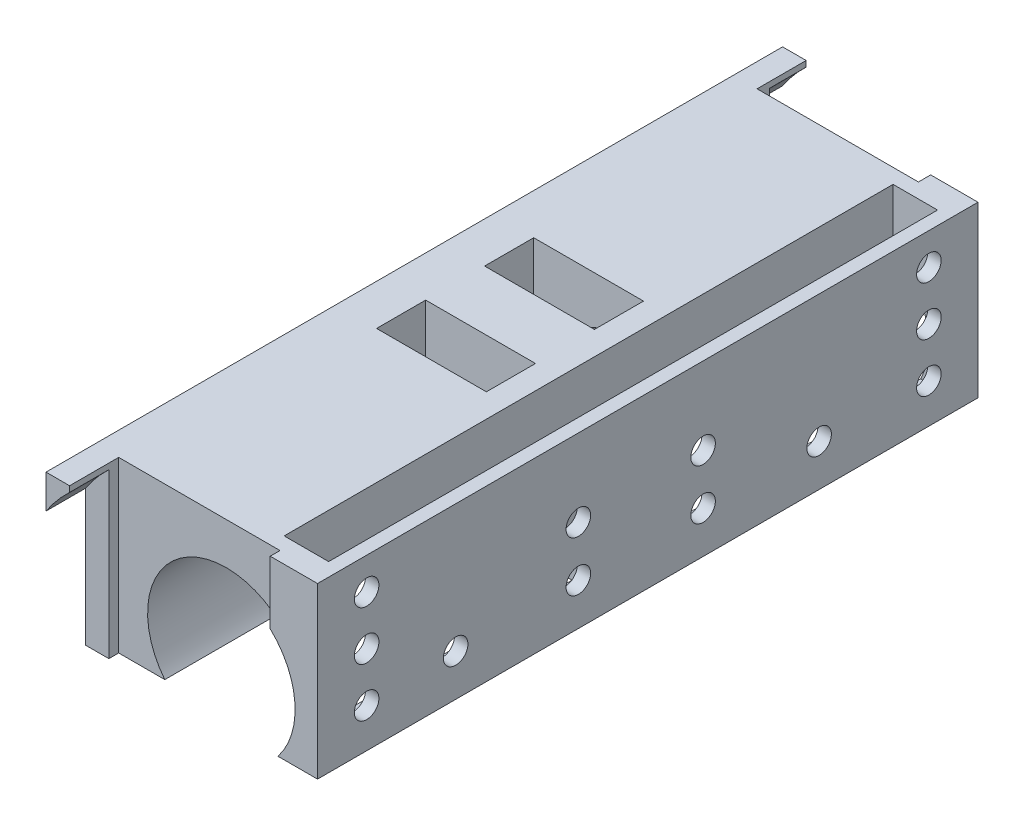
from build123d import *

# Parameters (mm, degrees)
CUBE_W                    = 150
CUBE_H                    = 150
BOSS_EXTRU_1_DEPTH        = 34.5
PAVE_W                    = 96
PAVE_H                    = 144
ENL_V_MAT_EXTRU_1_DEPTH   = 31.5
VIS1_R                    = 2.5
ENL_V_MAT_EXTRU_2_DEPTH   = 5
ENL_V_START               = -5
VIS2_R                    = 2.5
ENL_V_MAT_EXTRU_3_DEPTH   = 5
PAVE_PROCHE_MOTEUR_W      = 12.5
PAVE_PROCHE_MOTEUR_H      = 124
ENL_V_MAT_EXTRU_4_DEPTH   = 31.5
PAVE_ROUE_LIBRE_W         = 32.86
PAVE_ROUE_LIBRE_H         = 15.696676457
PAVE_ROUE_LIBRE_H_2       = 18.419496328
ENL_V_MAT_EXTRU_5_DEPTH   = 36
CABLES_W                  = 22.36
CABLES_H                  = 10
ENL_V_MAT_EXTRU_6_DEPTH   = 36
ROUE_EXT_R                = 32
ENL_V_MAT_EXTRU_7_DEPTH   = 8
ROUE_INTER_R              = 16.02
ENL_V_MAT_EXTRU_8_DEPTH   = 69
ENL_V_START_2             = -7.5
ROUE_EXT2_R               = 32
ENL_V_MAT_EXTRU_9_DEPTH   = 7.5
ENL_V_START_3             = -69
ROUE_INTER2_R             = 16.02
ENL_V_MAT_EXTRU_10_DEPTH  = 69
VIS_MOTEUR_POUR_SUPPORT_R = 2.5
ENL_V_MAT_EXTRU_11_DEPTH  = 10
BOSS_EXTRU_2_DEPTH        = 10
ESQUISSE2_R               = 2.5
ENL_V_MAT_EXTRU_12_DEPTH  = 10
ESQUISSE3_W               = 3.439870431
ESQUISSE3_H               = 124
BOSS_EXTRU_3_DEPTH        = 31
ESQUISSE5_W               = 3.439870431
ESQUISSE5_H               = 124
BOSS_EXTRU_4_DEPTH        = 0.5
ESQUISSE6_R               = 2.5
ENL_V_MAT_EXTRU_13_DEPTH  = 10
ESQUISSE7_R               = 2.5
ENL_V_MAT_EXTRU_14_DEPTH  = 10
ESQUISSE8_R               = 2.5
ENL_V_MAT_EXTRU_15_DEPTH  = 10
ESQUISSE10_W              = 102.704284834
ESQUISSE10_H              = 150
ENL_V_MAT_EXTRU_16_DEPTH  = 40


with BuildPart() as part:
    # Cube → Boss.-Extru.1 (new body)
    with BuildSketch(Plane(origin=(0, 0, 0), x_dir=(1, 0, 0), z_dir=(0, 1, 0))):
        with Locations((-34.210526316, -11.513157895)):
            Rectangle(CUBE_W, CUBE_H)
    extrude(amount=BOSS_EXTRU_1_DEPTH)

    # Pave → Enlèv. mat.-Extru.1 (cut)
    with BuildSketch(Plane(origin=(0, 34.5, 0), x_dir=(1, 0, 0), z_dir=(0, 1, 0))):
        with Locations((-10.210526316, -11.513157895)):
            Rectangle(PAVE_W, PAVE_H)
    extrude(amount=-ENL_V_MAT_EXTRU_1_DEPTH, mode=Mode.SUBTRACT)

    # Vis1 → Enlèv. mat.-Extru.2 (cut)
    with BuildSketch(Plane.XY.offset(86.513157895)):
        with Locations((33.789473684, 10)):
            Circle(VIS1_R)
        with Locations((33.789473684, 20)):
            Circle(VIS1_R)
        with Locations((33.789473684, 30)):
            Circle(VIS1_R)
    extrude(amount=-ENL_V_MAT_EXTRU_2_DEPTH, mode=Mode.SUBTRACT)

    # Vis2 → Enlèv. mat.-Extru.3 (cut)
    with BuildSketch(Plane(origin=(0, 0, -63.486842105), x_dir=(-1, 0, 0), z_dir=(0, 0, -1)).offset(ENL_V_START)):
        with Locations(Location((-33.789473684, 10, 0), (0, 0, 180))):
            Circle(VIS2_R)
        with Locations(Location((-33.789473684, 20, 0), (0, 0, 180))):
            Circle(VIS2_R)
        with Locations(Location((-33.789473684, 30, 0), (0, 0, 180))):
            Circle(VIS2_R)
    extrude(amount=ENL_V_MAT_EXTRU_3_DEPTH, mode=Mode.SUBTRACT)

    # Pave proche moteur → Enlèv. mat.-Extru.4 (cut)
    with BuildSketch(Plane(origin=(0, 34.5, 0), x_dir=(1, 0, 0), z_dir=(0, 1, 0))):
        with Locations((-67.460526316, -11.513157895)):
            Rectangle(PAVE_PROCHE_MOTEUR_W, PAVE_PROCHE_MOTEUR_H)
    extrude(amount=-ENL_V_MAT_EXTRU_4_DEPTH, mode=Mode.SUBTRACT)

    # Pave Roue libre → Enlèv. mat.-Extru.5 (cut)
    with BuildSketch(Plane(origin=(0, 34.5, 0), x_dir=(1, 0, 0), z_dir=(0, 1, 0))):
        with Locations((-87.980526316, 61.335180334)):
            Rectangle(PAVE_ROUE_LIBRE_W, PAVE_ROUE_LIBRE_H)
        with Locations((-87.980526316, -85.722906059)):
            Rectangle(PAVE_ROUE_LIBRE_W, PAVE_ROUE_LIBRE_H_2)
    extrude(amount=-ENL_V_MAT_EXTRU_5_DEPTH, mode=Mode.SUBTRACT)

    # Cables → Enlèv. mat.-Extru.6 (cut)
    with BuildSketch(Plane(origin=(0, 34.5, 0), x_dir=(1, 0, 0), z_dir=(0, 1, 0))):
        with Locations((-89.710526316, -0.513157895)):
            Rectangle(CABLES_W, CABLES_H)
        with Locations((-89.710526316, -22.513157895)):
            Rectangle(CABLES_W, CABLES_H)
    extrude(amount=-ENL_V_MAT_EXTRU_6_DEPTH, mode=Mode.SUBTRACT)

    # Roue ext → Enlèv. mat.-Extru.7 (cut)
    with BuildSketch(Plane.XY.offset(86.513157895)):
        with Locations((-82.5, 10)):
            Circle(ROUE_EXT_R)
    extrude(amount=-ENL_V_MAT_EXTRU_7_DEPTH, mode=Mode.SUBTRACT)

    # Roue inter → Enlèv. mat.-Extru.8 (cut)
    with BuildSketch(Plane.XY.offset(86.513157895)):
        with Locations((-82.5, 10)):
            Circle(ROUE_INTER_R)
    extrude(amount=-ENL_V_MAT_EXTRU_8_DEPTH, mode=Mode.SUBTRACT)

    # Roue ext2 → Enlèv. mat.-Extru.9 (cut)
    with BuildSketch(Plane(origin=(0, 0, -63.486842105), x_dir=(-1, 0, 0), z_dir=(0, 0, -1)).offset(ENL_V_START_2)):
        with Locations((82.5, 10)):
            Circle(ROUE_EXT2_R)
    extrude(amount=ENL_V_MAT_EXTRU_9_DEPTH, mode=Mode.SUBTRACT)

    # Roue inter2 → Enlèv. mat.-Extru.10 (cut)
    with BuildSketch(Plane(origin=(0, 0, -63.486842105), x_dir=(-1, 0, 0), z_dir=(0, 0, -1)).offset(ENL_V_START_3)):
        with Locations((82.5, 10)):
            Circle(ROUE_INTER2_R)
    extrude(amount=ENL_V_MAT_EXTRU_10_DEPTH, mode=Mode.SUBTRACT)

    # Vis Moteur pour support → Enlèv. mat.-Extru.11 (cut)
    with BuildSketch(Plane(origin=(-58.210526316, 0, 0), x_dir=(0, 0, -1), z_dir=(1, 0, 0))):
        with Locations((-68.513157895, 8)):
            Circle(VIS_MOTEUR_POUR_SUPPORT_R)
        with Locations((-68.513157895, 18)):
            Circle(VIS_MOTEUR_POUR_SUPPORT_R)
        with Locations((-68.513157895, 28)):
            Circle(VIS_MOTEUR_POUR_SUPPORT_R)
        with Locations((45.986842105, 8)):
            Circle(VIS_MOTEUR_POUR_SUPPORT_R)
        with Locations((45.986842105, 18)):
            Circle(VIS_MOTEUR_POUR_SUPPORT_R)
        with Locations((45.986842105, 28)):
            Circle(VIS_MOTEUR_POUR_SUPPORT_R)
    extrude(amount=-ENL_V_MAT_EXTRU_11_DEPTH, mode=Mode.SUBTRACT)

    # Esquisse1 → Boss.-Extru.2 (add)
    with BuildSketch(Plane(origin=(0, 3, 0), x_dir=(1, 0, 0), z_dir=(0, 1, 0))):
        Polygon((-58.210526316, -15.513157895), (-14.210526316, -15.513157895), (-14.210526316, -83.513157895), (-6.210526316, -83.513157895), (-6.210526316, -15.513157895), (37.789473684, -15.513157895), (37.789473684, -7.513157895), (-6.210526316, -7.513157895), (-6.210526316, 60.486842105), (-14.210526316, 60.486842105), (-14.210526316, -7.513157895), (-58.210526316, -7.513157895), align=None)
    extrude(amount=BOSS_EXTRU_2_DEPTH)

    # Esquisse2 → Enlèv. mat.-Extru.12 (cut)
    with BuildSketch(Plane.XY.offset(15.513157895)):
        with Locations((-43.942882256, 8)):
            Circle(ESQUISSE2_R)
        with Locations((-26.88958752, 8)):
            Circle(ESQUISSE2_R)
        with Locations((9.588466595, 8)):
            Circle(ESQUISSE2_R)
        with Locations((23.56238511, 8)):
            Circle(ESQUISSE2_R)
    extrude(amount=-ENL_V_MAT_EXTRU_12_DEPTH, mode=Mode.SUBTRACT)

    # Esquisse3 → Boss.-Extru.3 (add)
    with BuildSketch(Plane(origin=(0, 3, 0), x_dir=(1, 0, 0), z_dir=(0, 1, 0))):
        with Locations((-62.930461532, -11.513157895)):
            Rectangle(ESQUISSE3_W, ESQUISSE3_H)
    extrude(amount=BOSS_EXTRU_3_DEPTH)

    # Esquisse5 → Boss.-Extru.4 (add)
    with BuildSketch(Plane(origin=(0, 34, 0), x_dir=(1, 0, 0), z_dir=(0, 1, 0))):
        with Locations((-62.930461532, -11.513157895)):
            Rectangle(ESQUISSE5_W, ESQUISSE5_H)
    extrude(amount=BOSS_EXTRU_4_DEPTH)

    # Esquisse6 → Enlèv. mat.-Extru.13 (cut)
    with BuildSketch(Plane(origin=(-58.210526316, 0, 0), x_dir=(0, 0, -1), z_dir=(1, 0, 0))):
        with Locations((-68.513157895, 28)):
            Circle(ESQUISSE6_R)
        with Locations((-68.513157895, 18)):
            Circle(ESQUISSE6_R)
        with Locations((-68.513157895, 8)):
            Circle(ESQUISSE6_R)
        with Locations((45.986842105, 28)):
            Circle(ESQUISSE6_R)
        with Locations((45.986842105, 18)):
            Circle(ESQUISSE6_R)
        with Locations((45.986842105, 8)):
            Circle(ESQUISSE6_R)
    extrude(amount=-ENL_V_MAT_EXTRU_13_DEPTH, mode=Mode.SUBTRACT)

    # Esquisse7 → Enlèv. mat.-Extru.14 (cut)
    with BuildSketch(Plane(origin=(-58.210526316, 0, 0), x_dir=(0, 0, -1), z_dir=(1, 0, 0))):
        with Locations((0, 8.527871685)):
            Circle(ESQUISSE7_R)
        with Locations((0, 18.750861141)):
            Circle(ESQUISSE7_R)
        with Locations((-25.400224022, 8.527871685)):
            Circle(ESQUISSE7_R)
        with Locations((-25.400224022, 18.750861141)):
            Circle(ESQUISSE7_R)
        with Locations((-50.386538843, 8.527871685)):
            Circle(ESQUISSE7_R)
        with Locations((23.629525814, 8.527871685)):
            Circle(ESQUISSE7_R)
    extrude(amount=-ENL_V_MAT_EXTRU_14_DEPTH, mode=Mode.SUBTRACT)

    # Esquisse8 → Enlèv. mat.-Extru.15 (cut)
    with BuildSketch(Plane(origin=(0, 3, 0), x_dir=(1, 0, 0), z_dir=(0, 1, 0))):
        with Locations(Location((19.789473684, -43.513157895, 0), (0, 0, 270))):
            Circle(ESQUISSE8_R)
        with Locations(Location((19.789473684, 20.486842105, 0), (0, 0, 270))):
            Circle(ESQUISSE8_R)
    extrude(amount=-ENL_V_MAT_EXTRU_15_DEPTH, mode=Mode.SUBTRACT)

    # Esquisse10 → Enlèv. mat.-Extru.16 (cut)
    with BuildSketch(Plane(origin=(0, 34.5, 0), x_dir=(1, 0, 0), z_dir=(0, 1, 0))):
        with Locations((-10.562668733, -11.513157895)):
            Rectangle(ESQUISSE10_W, ESQUISSE10_H)
    extrude(amount=-ENL_V_MAT_EXTRU_16_DEPTH, mode=Mode.SUBTRACT)


solid = part.part
